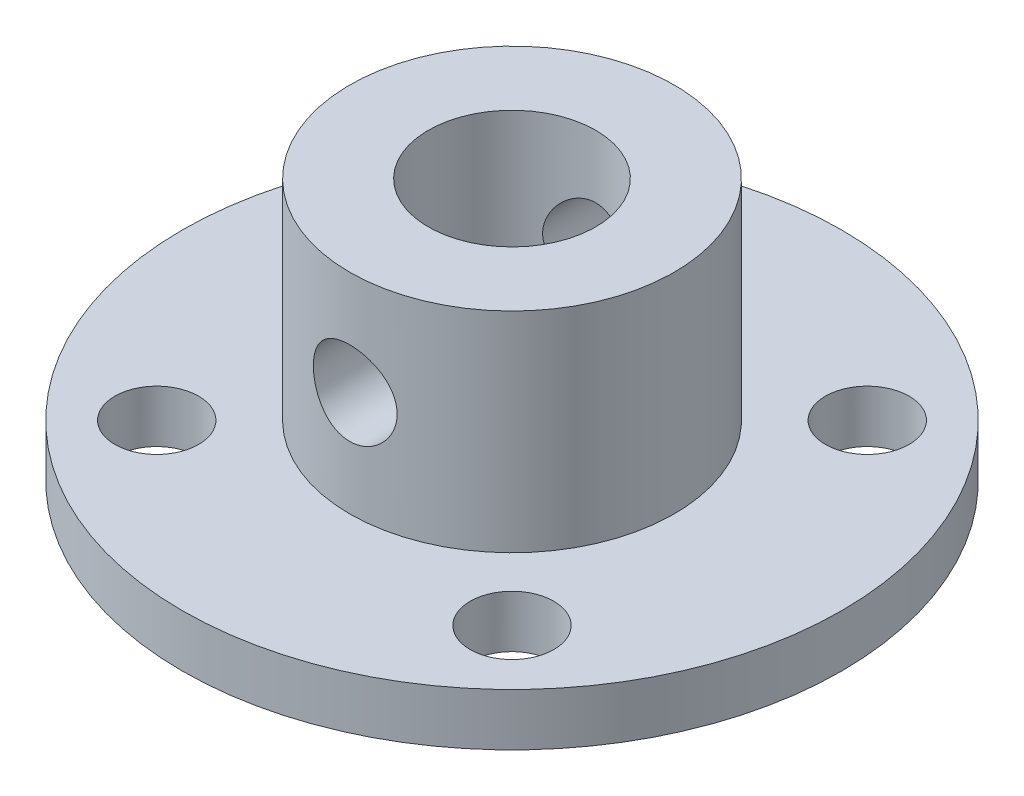
from build123d import *

# Parameters (mm, degrees)
SKETCH1_R               = 15.75
BOSS_EXTRUDE1_DEPTH     = 2.5
SKETCH2_R               = 7.75
BOSS_EXTRUDE2_DEPTH     = 10
SKETCH3_R               = 4
CUT_EXTRUDE1_DEPTH      = 26.541632681
CUT_EXTRUDE2_DEPTH      = 26.541632681
CUT_EXTRUDE2_DEPTH_BACK = 26.541632681
SKETCH4_R               = 2
SKETCH5_R               = 2
CUT_EXTRUDE3_DEPTH      = 26.54163273


with BuildPart() as part:
    # Sketch1 → Boss-Extrude1 (new body)
    with BuildSketch(Plane(origin=(0, 0, 0), x_dir=(1, 0, 0), z_dir=(0, 1, 0))):
        with Locations(Location((0, 0, 0), (0, 0, 270))):
            Circle(SKETCH1_R)
    extrude(amount=BOSS_EXTRUDE1_DEPTH)

    # Sketch2 → Boss-Extrude2 (add)
    with BuildSketch(Plane(origin=(0, 2.5, 0), x_dir=(1, 0, 0), z_dir=(0, 1, 0))):
        with Locations(Location((0, 0, 0), (0, 0, 270))):
            Circle(SKETCH2_R)
    extrude(amount=BOSS_EXTRUDE2_DEPTH)

    # Sketch3 → Cut-Extrude1 (cut, through all)
    with BuildSketch(Plane.XZ):
        with Locations(Location((0, 0, 0), (0, 0, 270))):
            Circle(SKETCH3_R)
    extrude(amount=-CUT_EXTRUDE1_DEPTH, mode=Mode.SUBTRACT)

    # Sketch4 → Cut-Extrude2 (cut, two sides: drawn at the far end of the back side and taken through both)
    with BuildSketch(Plane.XY.offset(-CUT_EXTRUDE2_DEPTH_BACK)):
        with Locations((0, 7.5)):
            Circle(SKETCH4_R)
    extrude(amount=CUT_EXTRUDE2_DEPTH + CUT_EXTRUDE2_DEPTH_BACK, mode=Mode.SUBTRACT)

    # Sketch5 → Cut-Extrude3 (cut, through all)
    with BuildSketch(Plane.XZ):
        with Locations(Location((8.485281374, 8.485281374, 0), (0, 0, 270))):
            Circle(SKETCH5_R)
        with Locations(Location((8.485281374, -8.485281374, 0), (0, 0, 270))):
            Circle(SKETCH5_R)
        with Locations(Location((-8.485281374, -8.485281374, 0), (0, 0, 270))):
            Circle(SKETCH5_R)
        with Locations(Location((-8.485281374, 8.485281374, 0), (0, 0, 270))):
            Circle(SKETCH5_R)
    extrude(amount=-CUT_EXTRUDE3_DEPTH, mode=Mode.SUBTRACT)


solid = part.part
